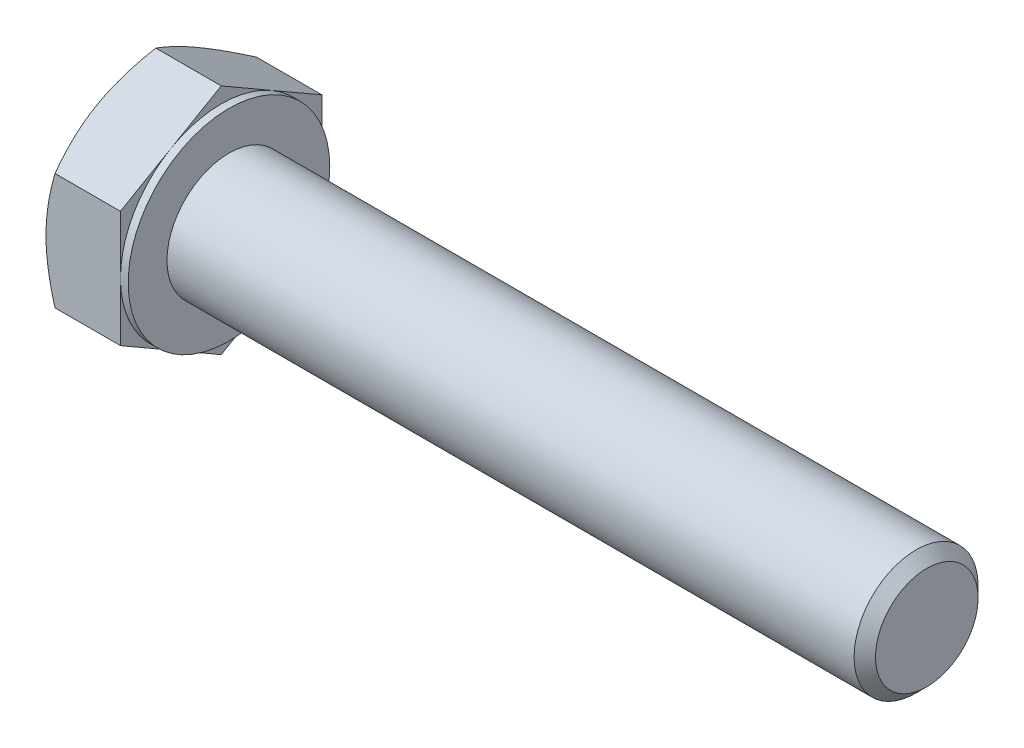
from build123d import *

# Parameters (mm, degrees)
BASEHEAD_DEPTH = 5.3
SKETCH4_W      = 0.5
SKETCH4_H      = 11.005553499


with BuildPart() as part:
    # Sketch1 → BaseHead (new body)
    with BuildSketch(Plane(origin=(0, 0, 0), x_dir=(0, 0, -1), z_dir=(1, 0, 0))):
        Polygon((6.5, 3.75277675), (6.5, -3.75277675), (0, -7.505553499), (-6.5, -3.75277675), (-6.5, 3.75277675), (0, 7.505553499), align=None)
    extrude(amount=BASEHEAD_DEPTH)

    # BodySke → BaseBody (revolve)
    with BuildSketch(Plane.XY, mode=Mode.PRIVATE) as basebody_sk:
        Polygon((0, 0), (50.3, 0), (50.3, 3.3095), (49.6095, 4), (0, 4), align=None)
    revolve(basebody_sk.sketch.rotate(Axis((0, 0, 0), (1, 0, 0)), 90), axis=Axis((0, 0, 0), (1, 0, 0)))

    # Sketch3 → HeadChamfer (revolve, cut)
    with BuildSketch(Plane.XY):
        Polygon((0, 6.5), (3.46730793, 12.505553499), (3.46730793, 17.505553499), (-10, 17.505553499), (-10, 6.5), align=None)
    revolve(axis=Axis((0, 0, 0), (1, 0, 0)), mode=Mode.SUBTRACT)

    # Sketch4 → BearingFace (revolve, cut)
    with BuildSketch(Plane.XY, mode=Mode.PRIVATE) as bearingface_sk:
        with Locations((5.05, 12.00277675)):
            Rectangle(SKETCH4_W, SKETCH4_H)
    revolve(bearingface_sk.sketch.rotate(Axis((0, 0, 0), (1, 0, 0)), 270), axis=Axis((0, 0, 0), (1, 0, 0)), mode=Mode.SUBTRACT)


solid = part.part
